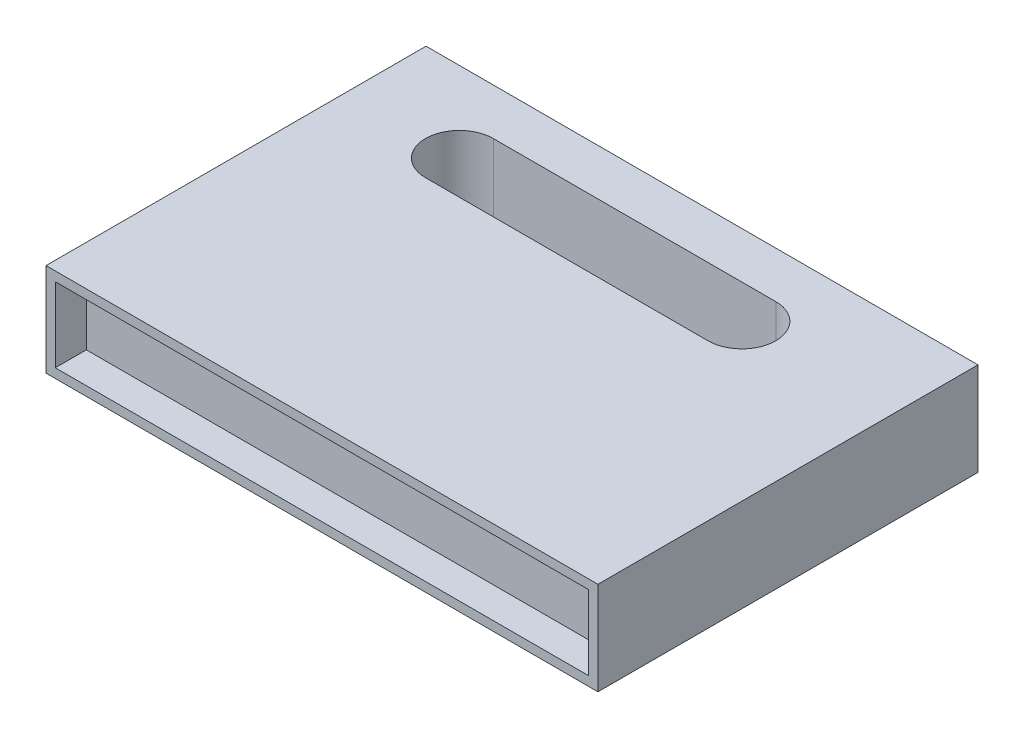
from build123d import *

# Parameters (mm, degrees)
SKETCH1_W           = 177.730901972
SKETCH1_H           = 122.376165744
BOSS_EXTRUDE1_DEPTH = 30
SKETCH2_W           = 171.730901972
SKETCH2_H           = 24
CUT_EXTRUDE1_DEPTH  = 10
CUT_EXTRUDE2_DEPTH  = 112.986828978


with BuildPart() as part:
    # Sketch1 → Boss-Extrude1 (new body)
    with BuildSketch(Plane(origin=(0, 0, 0), x_dir=(1, 0, 0), z_dir=(0, 1, 0))):
        Rectangle(SKETCH1_W, SKETCH1_H)
    extrude(amount=BOSS_EXTRUDE1_DEPTH)

    # Sketch2 → Cut-Extrude1 (cut)
    with BuildSketch(Plane.XY.offset(61.188082872)):
        with Locations((0, 15)):
            Rectangle(SKETCH2_W, SKETCH2_H)
    extrude(amount=-CUT_EXTRUDE1_DEPTH, mode=Mode.SUBTRACT)

    # Sketch3 → Cut-Extrude2 (cut, through all)
    with BuildSketch(Plane(origin=(0, 30, 0), x_dir=(1, 0, 0), z_dir=(0, 1, 0))):
        with BuildLine():
            Line((-52.291434111, 46.257807098), (38.691830368, 46.257807098))
            ThreePointArc((38.691830368, 46.257807098), (49.609822105, 35.339815361), (38.691830368, 24.421823623))
            Line((38.691830368, 24.421823623), (-52.291434111, 24.421823623))
            ThreePointArc((-52.291434111, 24.421823623), (-63.209425848, 35.339815361), (-52.291434111, 46.257807098))
        make_face()
    extrude(amount=-CUT_EXTRUDE2_DEPTH, mode=Mode.SUBTRACT)


solid = part.part
